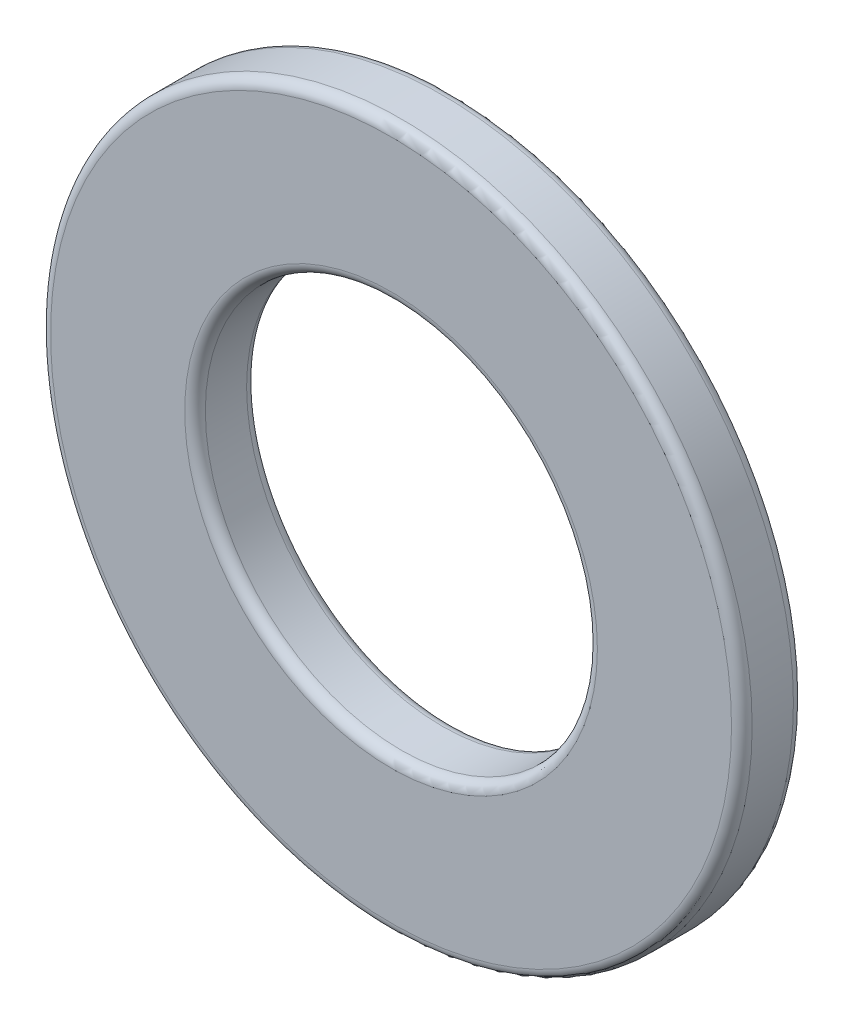
from build123d import *

# Parameters (mm, degrees)
SKETCH1_R           = 17
SKETCH1_R_2         = 9.5
BOSS_EXTRUDE1_DEPTH = 3
FILLET1_R           = 0.5


with BuildPart() as part:
    # Sketch1 → Boss-Extrude1 (new body)
    with BuildSketch(Plane.XY):
        Circle(SKETCH1_R)
        Circle(SKETCH1_R_2, mode=Mode.SUBTRACT)
    extrude(amount=BOSS_EXTRUDE1_DEPTH)

    # Fillet1
    fillet1_edges = [part.edges().sort_by_distance(p)[0] for p in [
        (-17, 0, 0),
        (-17, 0, 3),
        (-9.5, 0, 0),
        (-9.5, 0, 3),
    ]]
    fillet(fillet1_edges, radius=FILLET1_R)


solid = part.part
